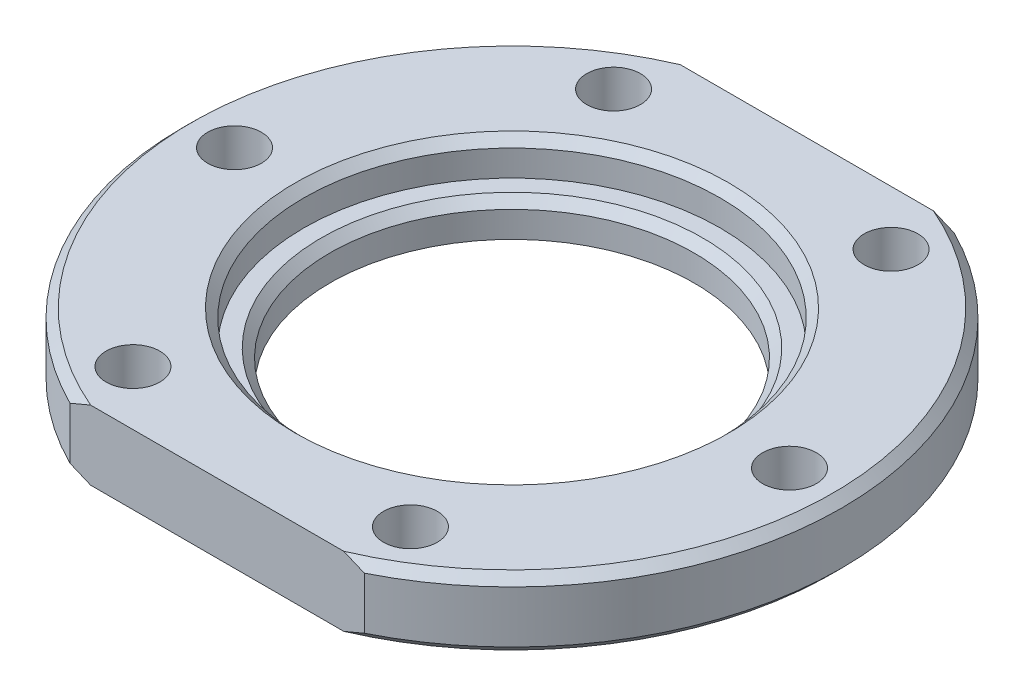
from build123d import *

# Parameters (mm, degrees)
SKETCH1_R           = 10.5
SKETCH1_R_2         = 1.55
BOSS_EXTRUDE1_DEPTH = 4
SKETCH2_R           = 12
CUT_EXTRUDE1_DEPTH  = 2
CHAMFER1_SIZE       = 0.5


with BuildPart() as part:
    # Sketch1 → Boss-Extrude1 (new body)
    with BuildSketch(Plane(origin=(0, 0, 0), x_dir=(1, 0, 0), z_dir=(0, 1, 0))):
        with BuildLine():
            Line((-8.485281374, 17), (8.485281374, 17))
            ThreePointArc((8.485281374, 17), (19, 0), (8.485281374, -17))
            Line((8.485281374, -17), (-8.485281374, -17))
            ThreePointArc((-8.485281374, -17), (-19, 0), (-8.485281374, 17))
        make_face()
        with Locations(Location((0, 0, 0), (0, 0, 270))):
            Circle(SKETCH1_R, mode=Mode.SUBTRACT)
        with Locations(Location((-16, 0, 0), (0, 0, 270))):
            Circle(SKETCH1_R_2, mode=Mode.SUBTRACT)
        with Locations(Location((-8, 13.856406461, 0), (0, 0, 270))):
            Circle(SKETCH1_R_2, mode=Mode.SUBTRACT)
        with Locations(Location((8, 13.856406461, 0), (0, 0, 270))):
            Circle(SKETCH1_R_2, mode=Mode.SUBTRACT)
        with Locations(Location((16, 0, 0), (0, 0, 270))):
            Circle(SKETCH1_R_2, mode=Mode.SUBTRACT)
        with Locations(Location((8, -13.856406461, 0), (0, 0, 270))):
            Circle(SKETCH1_R_2, mode=Mode.SUBTRACT)
        with Locations(Location((-8, -13.856406461, 0), (0, 0, 270))):
            Circle(SKETCH1_R_2, mode=Mode.SUBTRACT)
    extrude(amount=BOSS_EXTRUDE1_DEPTH)

    # Sketch2 → Cut-Extrude1 (cut)
    with BuildSketch(Plane(origin=(0, 4, 0), x_dir=(1, 0, 0), z_dir=(0, 1, 0))):
        with Locations(Location((0, 0, 0), (0, 0, 270))):
            Circle(SKETCH2_R)
    extrude(amount=-CUT_EXTRUDE1_DEPTH, mode=Mode.SUBTRACT)

    # Chamfer1
    chamfer1_edges = [part.edges().sort_by_distance(p)[0] for p in [
        (-19, 4, 0),
        (0, 2, -10.5),
        (0, 4, -12),
        (19, 4, 0),
        (-19, 0, 0),
        (19, 0, 0),
    ]]
    chamfer(chamfer1_edges, length=CHAMFER1_SIZE)


solid = part.part
